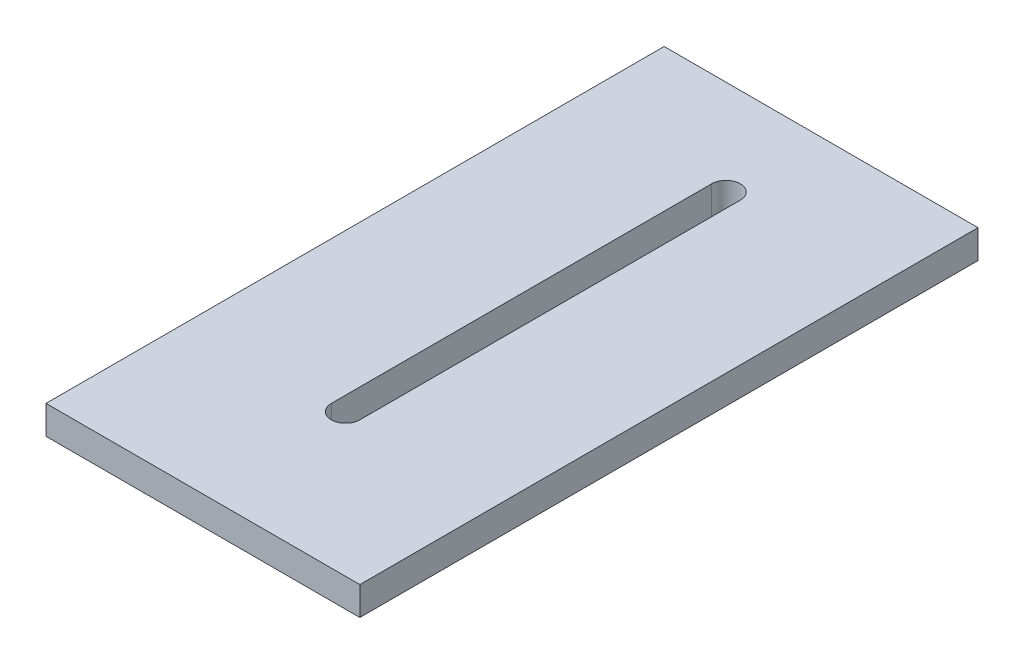
from build123d import *

# Parameters (mm, degrees)
SKETCH_2_W      = 33
SKETCH_2_H      = 65
EXTRUDE_1_DEPTH = 3


with BuildPart() as part:
    # 草图2 → 凸台-拉伸1 (new body)
    with BuildSketch(Plane(origin=(0, 0, 0), x_dir=(1, 0, 0), z_dir=(0, 1, 0))):
        with Locations((16.5, 32.5)):
            Rectangle(SKETCH_2_W, SKETCH_2_H)
        with BuildLine():
            Line((15, 15), (15, 55))
            ThreePointArc((15, 55), (16.5, 56.5), (18, 55))
            Line((18, 55), (18, 15))
            ThreePointArc((18, 15), (16.5, 13.5), (15, 15))
        make_face(mode=Mode.SUBTRACT)
    extrude(amount=EXTRUDE_1_DEPTH)


solid = part.part
